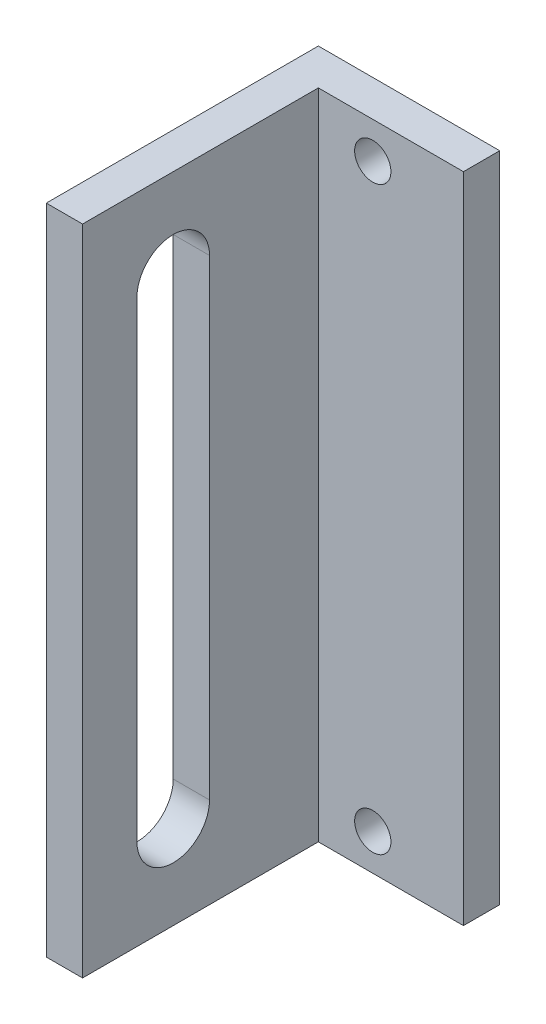
from build123d import *

# Parameters (mm, degrees)
SKETCH2_W           = 10
SKETCH2_H           = 36
BOSS_EXTRUDE1_DEPTH = 2
SKETCH3_R           = 1
CUT_EXTRUDE1_DEPTH  = 2
SKETCH4_W           = 2
SKETCH4_H           = 36
BOSS_EXTRUDE2_DEPTH = 13
CUT_EXTRUDE2_DEPTH  = 10


with BuildPart() as part:
    # Sketch2 → Boss-Extrude1 (new body)
    with BuildSketch(Plane.XY):
        Rectangle(SKETCH2_W, SKETCH2_H)
    extrude(amount=BOSS_EXTRUDE1_DEPTH)

    # Sketch3 → Cut-Extrude1 (cut)
    with BuildSketch(Plane.XY.offset(2)):
        with Locations((0, 16)):
            Circle(SKETCH3_R)
        with Locations((0, -16)):
            Circle(SKETCH3_R)
    extrude(amount=-CUT_EXTRUDE1_DEPTH, mode=Mode.SUBTRACT)

    # Sketch4 → Boss-Extrude2 (add)
    with BuildSketch(Plane.XY.offset(2)):
        with Locations((-4, 0)):
            Rectangle(SKETCH4_W, SKETCH4_H)
    extrude(amount=BOSS_EXTRUDE2_DEPTH)

    # Sketch5 → Cut-Extrude2 (cut)
    with BuildSketch(Plane(origin=(-3, 0, 0), x_dir=(0, 0, -1), z_dir=(1, 0, 0))):
        with BuildLine():
            Line((-8, 13), (-8, -13))
            ThreePointArc((-8, -13), (-10, -15), (-12, -13))
            Line((-12, -13), (-12, 13))
            ThreePointArc((-12, 13), (-10, 15), (-8, 13))
        make_face()
    extrude(amount=-CUT_EXTRUDE2_DEPTH, mode=Mode.SUBTRACT)


solid = part.part
